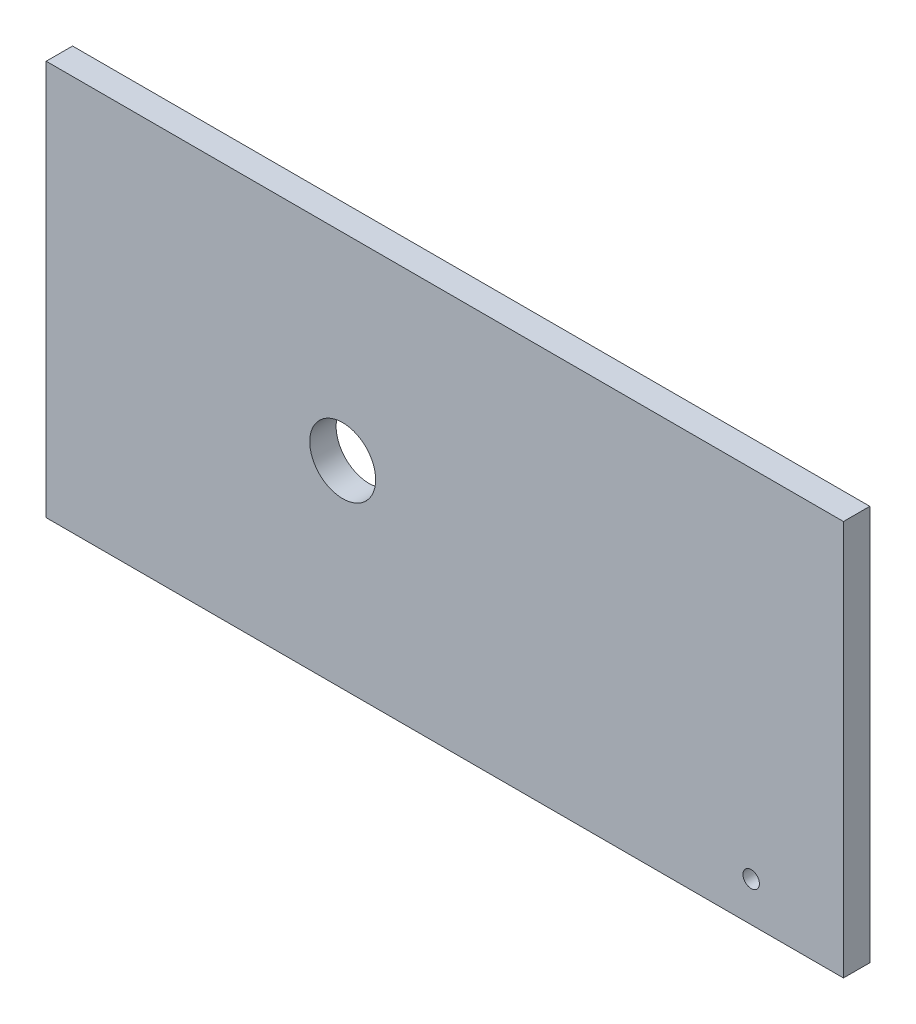
from build123d import *

# Parameters (mm, degrees)
SKETCH1_W           = 121
SKETCH1_H           = 60
SKETCH1_R           = 5
SKETCH1_R_2         = 1.25
BOSS_EXTRUDE1_DEPTH = 4


with BuildPart() as part:
    # Sketch1 → Boss-Extrude1 (new body)
    with BuildSketch(Plane.XY):
        with Locations((-20.5, 0)):
            Rectangle(SKETCH1_W, SKETCH1_H)
        with Locations((-36, 0)):
            Circle(SKETCH1_R, mode=Mode.SUBTRACT)
        with Locations((26, -24)):
            Circle(SKETCH1_R_2, mode=Mode.SUBTRACT)
    extrude(amount=BOSS_EXTRUDE1_DEPTH)


solid = part.part
